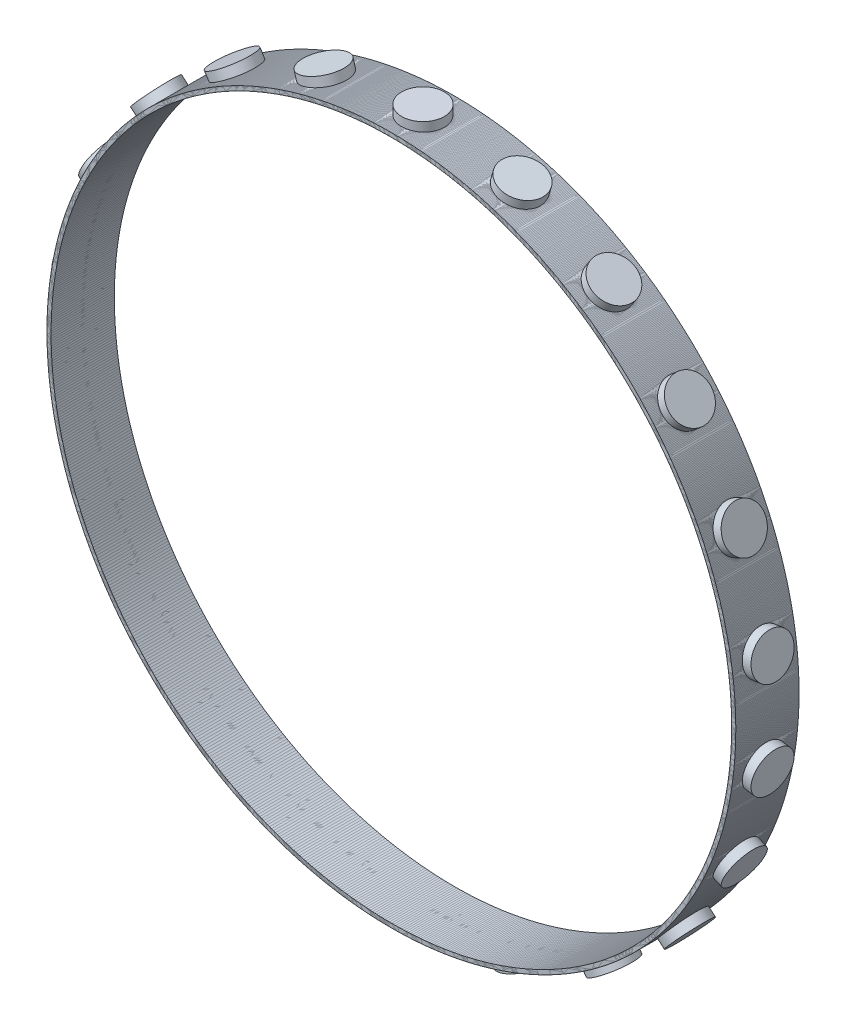
from build123d import *

# Parameters (mm, degrees)
SKETCH1_R           = 55.3085
SKETCH1_R_2         = 54.6735
BOSS_EXTRUDE1_DEPTH = 10.16
BOSS_EXTRUDE2_START = 54.6862
SKETCH2_R           = 3.429
BOSS_EXTRUDE2_DEPTH = 2.032
CIRPATTERN2_COUNT   = 22


with BuildPart() as part:
    # Sketch1 → Boss-Extrude1 (new body)
    with BuildSketch(Plane.XY):
        Circle(SKETCH1_R)
        Circle(SKETCH1_R_2, mode=Mode.SUBTRACT)
    extrude(amount=BOSS_EXTRUDE1_DEPTH)

    # Sketch2 → Boss-Extrude2 (add)
    with BuildSketch(Plane(origin=(0, 0, 0), x_dir=(1, 0, 0), z_dir=(0, 1, 0)).offset(BOSS_EXTRUDE2_START)):
        with Locations(Location((0, -5.08, 0), (0, 0, 90))):
            Circle(SKETCH2_R)
    extrude(amount=BOSS_EXTRUDE2_DEPTH)


with BuildPart() as cirpattern2_1:
    # CirPattern2: pattern copy
    add(part.part.rotate(Axis((0, 0, 0), (0, 0, 1)), 1 * 360 / CIRPATTERN2_COUNT))


with BuildPart() as cirpattern2_2:
    # CirPattern2: pattern copy
    add(part.part.rotate(Axis((0, 0, 0), (0, 0, 1)), 2 * 360 / CIRPATTERN2_COUNT))


with BuildPart() as cirpattern2_3:
    # CirPattern2: pattern copy
    add(part.part.rotate(Axis((0, 0, 0), (0, 0, 1)), 3 * 360 / CIRPATTERN2_COUNT))


with BuildPart() as cirpattern2_4:
    # CirPattern2: pattern copy
    add(part.part.rotate(Axis((0, 0, 0), (0, 0, 1)), 4 * 360 / CIRPATTERN2_COUNT))


with BuildPart() as cirpattern2_5:
    # CirPattern2: pattern copy
    add(part.part.rotate(Axis((0, 0, 0), (0, 0, 1)), 5 * 360 / CIRPATTERN2_COUNT))


with BuildPart() as cirpattern2_6:
    # CirPattern2: pattern copy
    add(part.part.rotate(Axis((0, 0, 0), (0, 0, 1)), 6 * 360 / CIRPATTERN2_COUNT))


with BuildPart() as cirpattern2_7:
    # CirPattern2: pattern copy
    add(part.part.rotate(Axis((0, 0, 0), (0, 0, 1)), 7 * 360 / CIRPATTERN2_COUNT))


with BuildPart() as cirpattern2_8:
    # CirPattern2: pattern copy
    add(part.part.rotate(Axis((0, 0, 0), (0, 0, 1)), 8 * 360 / CIRPATTERN2_COUNT))


with BuildPart() as cirpattern2_9:
    # CirPattern2: pattern copy
    add(part.part.rotate(Axis((0, 0, 0), (0, 0, 1)), 9 * 360 / CIRPATTERN2_COUNT))


with BuildPart() as cirpattern2_10:
    # CirPattern2: pattern copy
    add(part.part.rotate(Axis((0, 0, 0), (0, 0, 1)), 10 * 360 / CIRPATTERN2_COUNT))


with BuildPart() as cirpattern2_11:
    # CirPattern2: pattern copy
    add(part.part.rotate(Axis((0, 0, 0), (0, 0, 1)), 11 * 360 / CIRPATTERN2_COUNT))


with BuildPart() as cirpattern2_12:
    # CirPattern2: pattern copy
    add(part.part.rotate(Axis((0, 0, 0), (0, 0, 1)), 12 * 360 / CIRPATTERN2_COUNT))


with BuildPart() as cirpattern2_13:
    # CirPattern2: pattern copy
    add(part.part.rotate(Axis((0, 0, 0), (0, 0, 1)), 13 * 360 / CIRPATTERN2_COUNT))


with BuildPart() as cirpattern2_14:
    # CirPattern2: pattern copy
    add(part.part.rotate(Axis((0, 0, 0), (0, 0, 1)), 14 * 360 / CIRPATTERN2_COUNT))


with BuildPart() as cirpattern2_15:
    # CirPattern2: pattern copy
    add(part.part.rotate(Axis((0, 0, 0), (0, 0, 1)), 15 * 360 / CIRPATTERN2_COUNT))


with BuildPart() as cirpattern2_16:
    # CirPattern2: pattern copy
    add(part.part.rotate(Axis((0, 0, 0), (0, 0, 1)), 16 * 360 / CIRPATTERN2_COUNT))


with BuildPart() as cirpattern2_17:
    # CirPattern2: pattern copy
    add(part.part.rotate(Axis((0, 0, 0), (0, 0, 1)), 17 * 360 / CIRPATTERN2_COUNT))


with BuildPart() as cirpattern2_18:
    # CirPattern2: pattern copy
    add(part.part.rotate(Axis((0, 0, 0), (0, 0, 1)), 18 * 360 / CIRPATTERN2_COUNT))


with BuildPart() as cirpattern2_19:
    # CirPattern2: pattern copy
    add(part.part.rotate(Axis((0, 0, 0), (0, 0, 1)), 19 * 360 / CIRPATTERN2_COUNT))


with BuildPart() as cirpattern2_20:
    # CirPattern2: pattern copy
    add(part.part.rotate(Axis((0, 0, 0), (0, 0, 1)), 20 * 360 / CIRPATTERN2_COUNT))


with BuildPart() as cirpattern2_21:
    # CirPattern2: pattern copy
    add(part.part.rotate(Axis((0, 0, 0), (0, 0, 1)), 21 * 360 / CIRPATTERN2_COUNT))


solid = Compound([part.part, cirpattern2_1.part, cirpattern2_2.part, cirpattern2_3.part, cirpattern2_4.part, cirpattern2_5.part, cirpattern2_6.part, cirpattern2_7.part, cirpattern2_8.part, cirpattern2_9.part, cirpattern2_10.part, cirpattern2_11.part, cirpattern2_12.part, cirpattern2_13.part, cirpattern2_14.part, cirpattern2_15.part, cirpattern2_16.part, cirpattern2_17.part, cirpattern2_18.part, cirpattern2_19.part, cirpattern2_20.part, cirpattern2_21.part])
